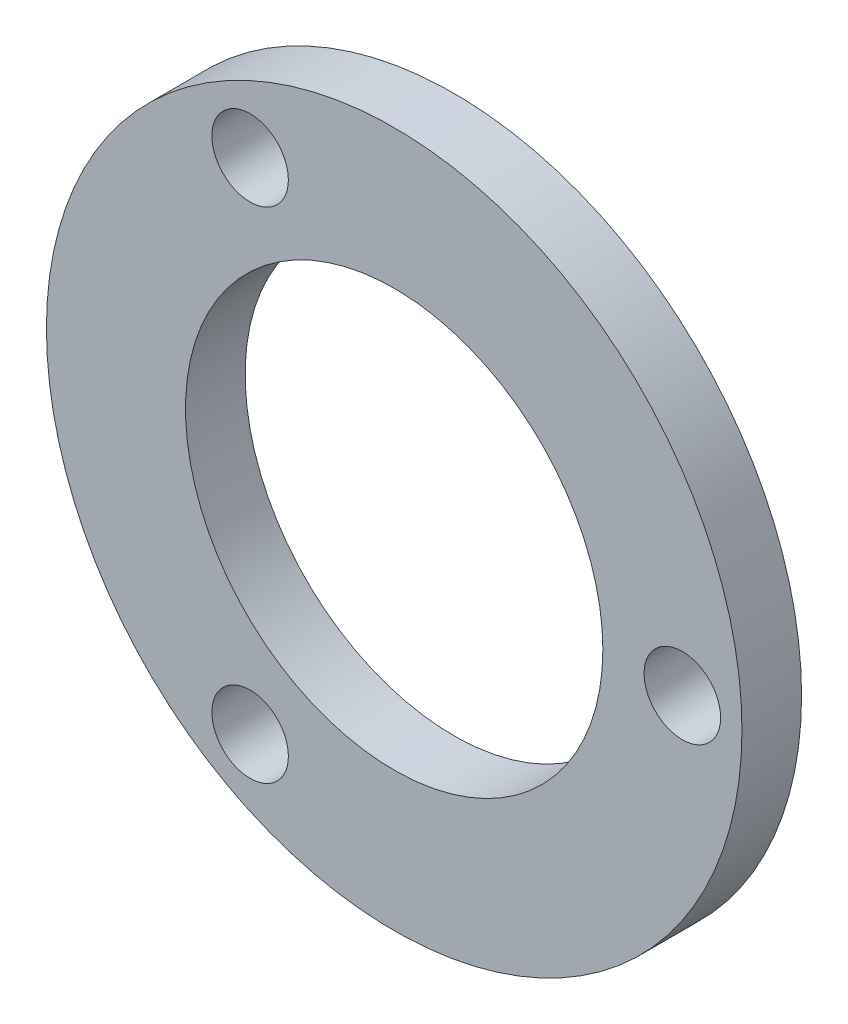
from build123d import *

# Parameters (mm, degrees)
ESQUISSE1_R        = 17.5
ESQUISSE1_R_2      = 1.925
ESQUISSE1_R_3      = 10.5
BOSS_EXTRU_1_DEPTH = 3


with BuildPart() as part:
    # Esquisse1 → Boss.-Extru.1 (new body)
    with BuildSketch(Plane.XY):
        with Locations((0.000221946, 0)):
            Circle(ESQUISSE1_R)
        with Locations((-7.250110973, -12.557560565)):
            Circle(ESQUISSE1_R_2, mode=Mode.SUBTRACT)
        with Locations((-7.250110973, 12.557560565)):
            Circle(ESQUISSE1_R_2, mode=Mode.SUBTRACT)
        with Locations((0.000221946, 0)):
            Circle(ESQUISSE1_R_3, mode=Mode.SUBTRACT)
        with Locations((14.500221946, 0)):
            Circle(ESQUISSE1_R_2, mode=Mode.SUBTRACT)
    extrude(amount=BOSS_EXTRU_1_DEPTH)


solid = part.part
